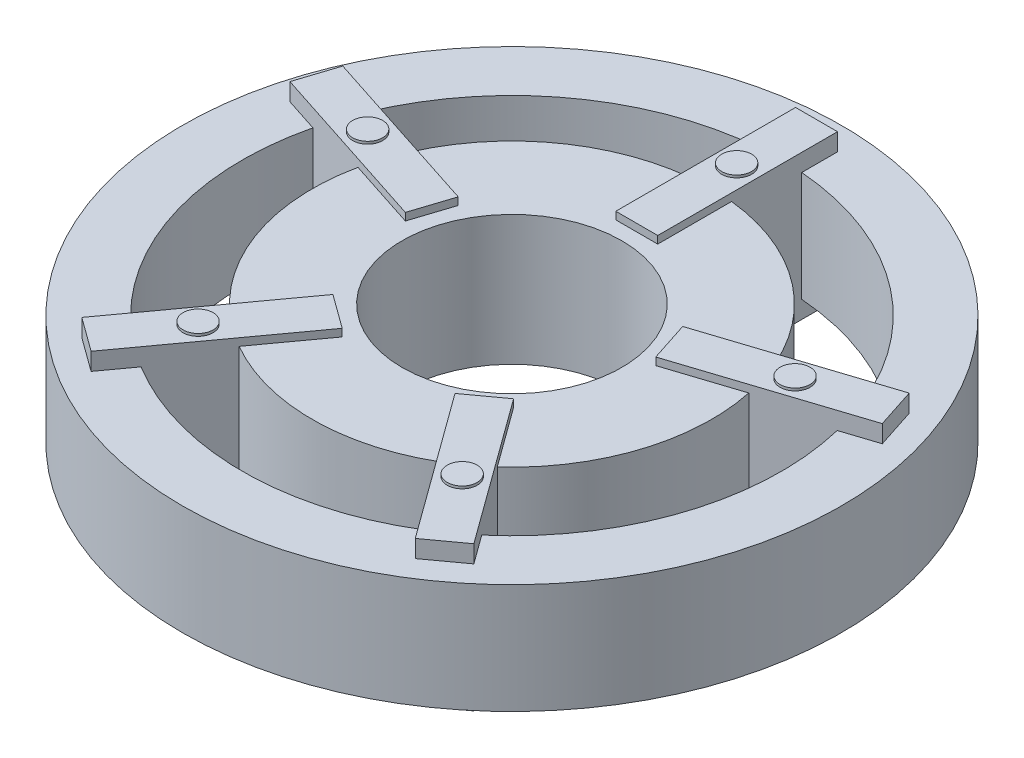
from build123d import *

# Parameters (mm, degrees)
SKETCH1_R            = 66
SKETCH1_R_2          = 54
RIM_OUTER_RING_DEPTH = 11
SKETCH2_R            = 40
SKETCH2_R_2          = 22
RIM_HUB_RING_DEPTH   = 13
RIM_SPOKE_1_DEPTH    = 14.5
SKETCH4_R            = 3
RIM_BOLT_PAD_1_DEPTH = 15
SKETCH5_W            = 8.4
SKETCH5_H            = 36
RIM_SPOKE_2_DEPTH    = 14.5
SKETCH6_R            = 3
RIM_BOLT_PAD_2_DEPTH = 15
RIM_SPOKE_3_DEPTH    = 14.5
SKETCH8_R            = 3
RIM_BOLT_PAD_3_DEPTH = 15
RIM_SPOKE_4_DEPTH    = 14.5
SKETCH10_R           = 3
RIM_BOLT_PAD_4_DEPTH = 15
RIM_SPOKE_5_DEPTH    = 14.5
SKETCH12_R           = 3
RIM_BOLT_PAD_5_DEPTH = 15


with BuildPart() as part:
    # Sketch1 → rim outer ring (new, symmetric)
    with BuildSketch(Plane(origin=(0, 0, 0), x_dir=(1, 0, 0), z_dir=(0, 1, 0))):
        with Locations(Location((0, 0, 0), (0, 0, 270))):
            Circle(SKETCH1_R)
        with Locations(Location((0, 0, 0), (0, 0, 270))):
            Circle(SKETCH1_R_2, mode=Mode.SUBTRACT)
    extrude(amount=RIM_OUTER_RING_DEPTH, both=True)



with BuildPart() as body_2:
    # Sketch2 → rim hub ring (new, symmetric)
    with BuildSketch(Plane(origin=(0, 0, 0), x_dir=(1, 0, 0), z_dir=(0, 1, 0))):
        with Locations(Location((0, 0, 0), (0, 0, 90))):
            Circle(SKETCH2_R)
        with Locations(Location((0, 0, 0), (0, 0, 90))):
            Circle(SKETCH2_R_2, mode=Mode.SUBTRACT)
    extrude(amount=RIM_HUB_RING_DEPTH, both=True)


with BuildPart() as part_1:
    add(part.part)

    add(body_2.part)  # rim spoke 1 merges body 2
    # Sketch3 → rim spoke 1 (add, symmetric)
    with BuildSketch(Plane(origin=(0, 0, 0), x_dir=(1, 0, 0), z_dir=(0, 1, 0))):
        Polygon((22.478541531, 11.719862228), (56.716576118, 22.844474025), (59.31231887, 14.855599288), (25.074284284, 3.730987491), align=None)
    extrude(amount=RIM_SPOKE_1_DEPTH, both=True)

    # Sketch4 → rim bolt pad 1 (add, symmetric)
    with BuildSketch(Plane(origin=(0, 0, 0), x_dir=(1, 0, 0), z_dir=(0, 1, 0))):
        with Locations(Location((42.797543233, 13.905764747, 0), (0, 0, 90))):
            Circle(SKETCH4_R)
    extrude(amount=RIM_BOLT_PAD_1_DEPTH, both=True)

    # Sketch5 → rim spoke 2 (add, symmetric)
    with BuildSketch(Plane(origin=(0, 0, 0), x_dir=(1, 0, 0), z_dir=(0, 1, 0))):
        with Locations((0, 43)):
            Rectangle(SKETCH5_W, SKETCH5_H)
    extrude(amount=RIM_SPOKE_2_DEPTH, both=True)

    # Sketch6 → rim bolt pad 2 (add, symmetric)
    with BuildSketch(Plane(origin=(0, 0, 0), x_dir=(1, 0, 0), z_dir=(0, 1, 0))):
        with Locations(Location((0, 45, 0), (0, 0, 90))):
            Circle(SKETCH6_R)
    extrude(amount=RIM_BOLT_PAD_2_DEPTH, both=True)

    # Sketch7 → rim spoke 3 (add, symmetric)
    with BuildSketch(Plane(origin=(0, 0, 0), x_dir=(1, 0, 0), z_dir=(0, 1, 0))):
        Polygon((-25.074284284, 3.730987491), (-59.31231887, 14.855599288), (-56.716576118, 22.844474025), (-22.478541531, 11.719862228), align=None)
    extrude(amount=RIM_SPOKE_3_DEPTH, both=True)

    # Sketch8 → rim bolt pad 3 (add, symmetric)
    with BuildSketch(Plane(origin=(0, 0, 0), x_dir=(1, 0, 0), z_dir=(0, 1, 0))):
        with Locations(Location((-42.797543233, 13.905764747, 0), (0, 0, 90))):
            Circle(SKETCH8_R)
    extrude(amount=RIM_BOLT_PAD_3_DEPTH, both=True)

    # Sketch9 → rim spoke 4 (add, symmetric)
    with BuildSketch(Plane(origin=(0, 0, 0), x_dir=(1, 0, 0), z_dir=(0, 1, 0))):
        Polygon((-11.296759931, -22.694122919), (-32.457029013, -51.818734717), (-39.252771766, -46.881338597), (-18.092502684, -17.7567268), align=None)
    extrude(amount=RIM_SPOKE_4_DEPTH, both=True)

    # Sketch10 → rim bolt pad 4 (add, symmetric)
    with BuildSketch(Plane(origin=(0, 0, 0), x_dir=(1, 0, 0), z_dir=(0, 1, 0))):
        with Locations(Location((-26.450336353, -36.405764747, 0), (0, 0, 90))):
            Circle(SKETCH10_R)
    extrude(amount=RIM_BOLT_PAD_4_DEPTH, both=True)

    # Sketch11 → rim spoke 5 (add, symmetric)
    with BuildSketch(Plane(origin=(0, 0, 0), x_dir=(1, 0, 0), z_dir=(0, 1, 0))):
        Polygon((18.092502684, -17.7567268), (39.252771766, -46.881338597), (32.457029013, -51.818734717), (11.296759931, -22.694122919), align=None)
    extrude(amount=RIM_SPOKE_5_DEPTH, both=True)

    # Sketch12 → rim bolt pad 5 (add, symmetric)
    with BuildSketch(Plane(origin=(0, 0, 0), x_dir=(1, 0, 0), z_dir=(0, 1, 0))):
        with Locations(Location((26.450336353, -36.405764747, 0), (0, 0, 90))):
            Circle(SKETCH12_R)
    extrude(amount=RIM_BOLT_PAD_5_DEPTH, both=True)


solid = part_1.part
